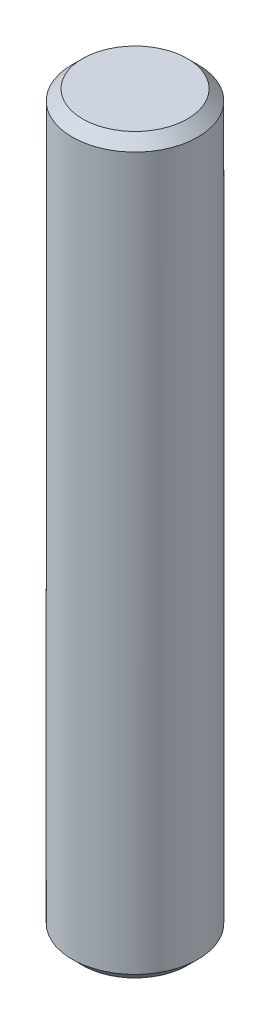
from build123d import *

# Parameters (mm, degrees)
SKETCH2_W     = 6
SKETCH2_H     = 70
CHAMFER1_SIZE = 1


with BuildPart() as part:
    # Sketch2 → Revolve1 (revolve)
    with BuildSketch(Plane.XY, mode=Mode.PRIVATE) as revolve1_sk:
        with Locations((3, 35)):
            Rectangle(SKETCH2_W, SKETCH2_H)
    revolve(revolve1_sk.sketch.rotate(Axis((0, 0, 0), (0, 1, 0)), 90), axis=Axis((0, 0, 0), (0, 1, 0)))

    # Chamfer1
    chamfer1_edges = [part.edges().sort_by_distance(p)[0] for p in [
        (0, 0, 6),
        (0, 70, 6),
    ]]
    chamfer(chamfer1_edges, length=CHAMFER1_SIZE)


solid = part.part
